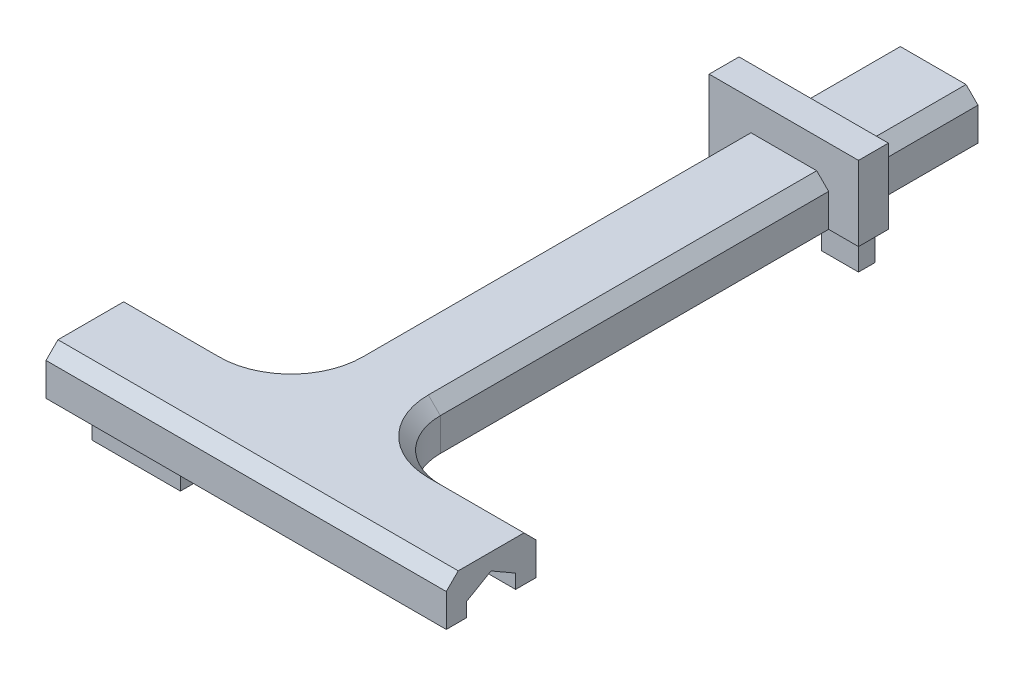
from build123d import *

# Parameters (mm, degrees)
BOSS_EXTRUDE1_DEPTH = 7.5
CUT_EXTRUDE6_DEPTH  = 5
BOSS_EXTRUDE2_START = -20
BOSS_EXTRUDE2_DEPTH = 5
CHAMFER1_SIZE       = 2
SKETCH11_W          = 14.8
SKETCH11_H          = 9.8
SKETCH11_W_2        = 6.2
SKETCH11_H_2        = 2.8
BOSS_EXTRUDE3_DEPTH = 4.8


with BuildPart() as part:
    # Sketch1 → Boss-Extrude1 (new body)
    with BuildSketch(Plane(origin=(0, 0, 0), x_dir=(1, 0, 0), z_dir=(0, 1, 0))):
        with BuildLine():
            Line((0, 0), (0, 15))
            Line((0, 15), (16, 15))
            ThreePointArc((16, 15), (23.071067812, 17.928932188), (26, 25))
            Line((26, 25), (26, 115))
            Line((26, 115), (41, 115))
            Line((41, 115), (41, 25))
            ThreePointArc((41, 25), (43.928932188, 17.928932188), (51, 15))
            Line((51, 15), (67, 15))
            Line((67, 15), (67, 0))
            Line((67, 0), (0, 0))
        make_face()
    extrude(amount=BOSS_EXTRUDE1_DEPTH)

    # Cut-Sweep1: sweep along a path in Sketch2
    with BuildLine(Plane(origin=(0, 7.5, 0), x_dir=(1, 0, 0), z_dir=(0, 1, 0))) as cut_sweep1_path:
        Line((33.5, 115), (33.5, 7.5))
        Line((33.5, 7.5), (67, 7.5))
    # Sketch3 → Cut-Sweep1 (sweep, cut)
    with BuildSketch(Plane(origin=(0, 0, -115), x_dir=(-1, 0, 0), z_dir=(0, 0, -1))):
        Polygon((-37.6, 5.132863896), (-33.5, 2.765727793), (-29.4, 5.132863896), (-29.4, 9.867136104), (-33.5, 12.234272207), (-37.6, 9.867136104), align=None)
    sweep(path=cut_sweep1_path.line, transition=Transition.RIGHT, mode=Mode.SUBTRACT)

    # Sketch7 → Cut-Extrude6 (cut)
    with BuildSketch(Plane(origin=(0, 7.5, 0), x_dir=(1, 0, 0), z_dir=(0, 1, 0))):
        with BuildLine():
            Line((47.6, 11.6), (47.6, 3.4))
            Line((47.6, 3.4), (29.4, 3.4))
            Line((29.4, 3.4), (29.4, 21.6))
            Line((29.4, 21.6), (37.6, 21.6))
            Line((37.6, 21.6), (37.6, 20.6))
            ThreePointArc((37.6, 20.6), (40.236038969, 14.236038969), (46.6, 11.6))
            Line((46.6, 11.6), (47.6, 11.6))
        make_face()
    extrude(amount=-CUT_EXTRUDE6_DEPTH, mode=Mode.SUBTRACT)

    # Sketch10 → Boss-Extrude2 (add)
    with BuildSketch(Plane(origin=(0, 0, -115), x_dir=(-1, 0, 0), z_dir=(0, 0, -1)).offset(BOSS_EXTRUDE2_START)):
        Polygon((-41, 7.5), (-46, 7.5), (-46, -5), (-21, -5), (-21, 7.5), (-26, 7.5), (-26, 0), (-41, 0), align=None)
    extrude(amount=-BOSS_EXTRUDE2_DEPTH)

    # Chamfer1
    chamfer1_edges = [part.edges().sort_by_distance(p)[0] for p in [
        (26, 0, -57.5),
        (41, 0, -105),
        (33.5, 0, 0),
        (8, 0, -15),
        (23.071067812, 0, -17.928932188),
        (26, 0, -105),
        (41, 0, -57.5),
        (43.928932188, 0, -17.928932188),
        (59, 0, -15),
    ]]
    chamfer(chamfer1_edges, length=CHAMFER1_SIZE)

    # Sketch11 → Boss-Extrude3 (add)
    with BuildSketch(Plane(origin=(0, 7.5, 0), x_dir=(1, 0, 0), z_dir=(0, 1, 0))):
        with Locations((12.5, 7.5)):
            Rectangle(SKETCH11_W, SKETCH11_H)
        with Locations((25.2, 92.5)):
            Rectangle(SKETCH11_W_2, SKETCH11_H_2)
        with Locations((41.8, 92.5)):
            Rectangle(SKETCH11_W_2, SKETCH11_H_2)
    extrude(amount=BOSS_EXTRUDE3_DEPTH)


with BuildPart() as body_2:
    # Mirror1: mirrored copy
    add(part.part.mirror(Plane.ZX.offset(7.5)))


solid = body_2.part
